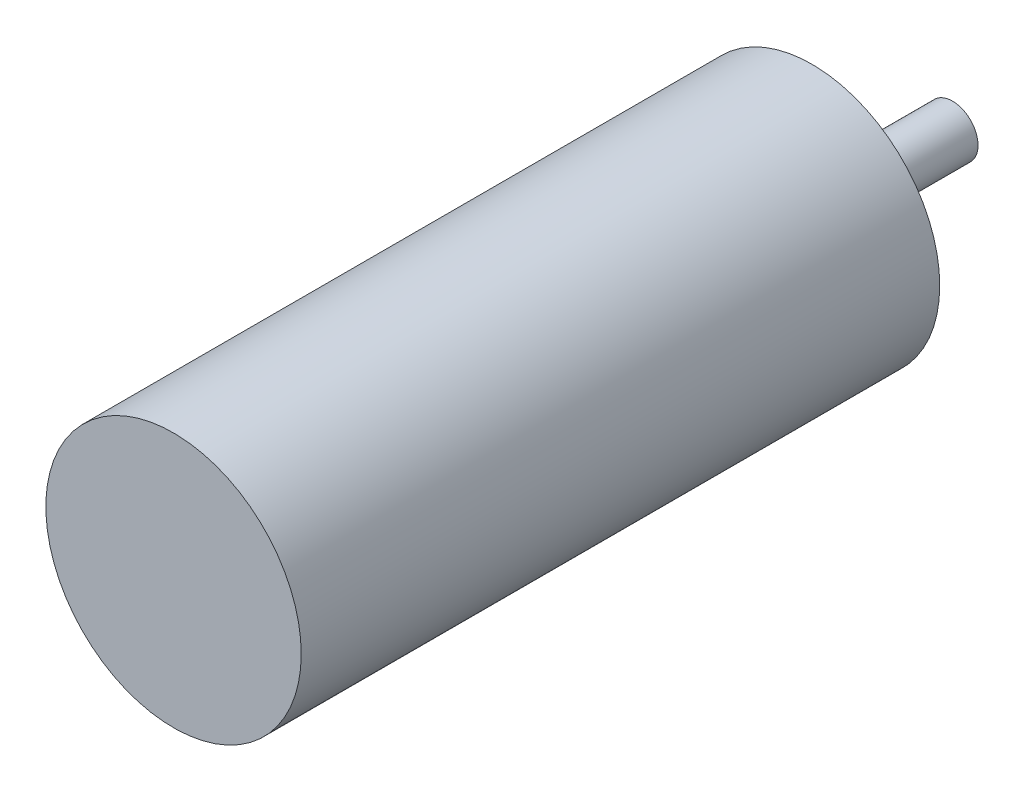
from build123d import *

# Parameters (mm, degrees)
SKETCH1_R           = 25
BOSS_EXTRUDE1_DEPTH = 125
SKETCH2_R           = 12.5
BOSS_EXTRUDE2_DEPTH = 2.5
SKETCH3_R           = 5
BOSS_EXTRUDE3_DEPTH = 25


with BuildPart() as part:
    # Sketch1 → Boss-Extrude1 (new body)
    with BuildSketch(Plane.XY):
        Circle(SKETCH1_R)
    extrude(amount=BOSS_EXTRUDE1_DEPTH)

    # Sketch2 → Boss-Extrude2 (add)
    with BuildSketch(Plane(origin=(0, 0, 0), x_dir=(-1, 0, 0), z_dir=(0, 0, -1))):
        with Locations(Location((0, 0, 0), (0, 0, 180))):
            Circle(SKETCH2_R)
    extrude(amount=BOSS_EXTRUDE2_DEPTH)

    # Sketch3 → Boss-Extrude3 (add)
    with BuildSketch(Plane(origin=(0, 0, -2.5), x_dir=(-1, 0, 0), z_dir=(0, 0, -1))):
        Circle(SKETCH3_R)
    extrude(amount=BOSS_EXTRUDE3_DEPTH)


solid = part.part
